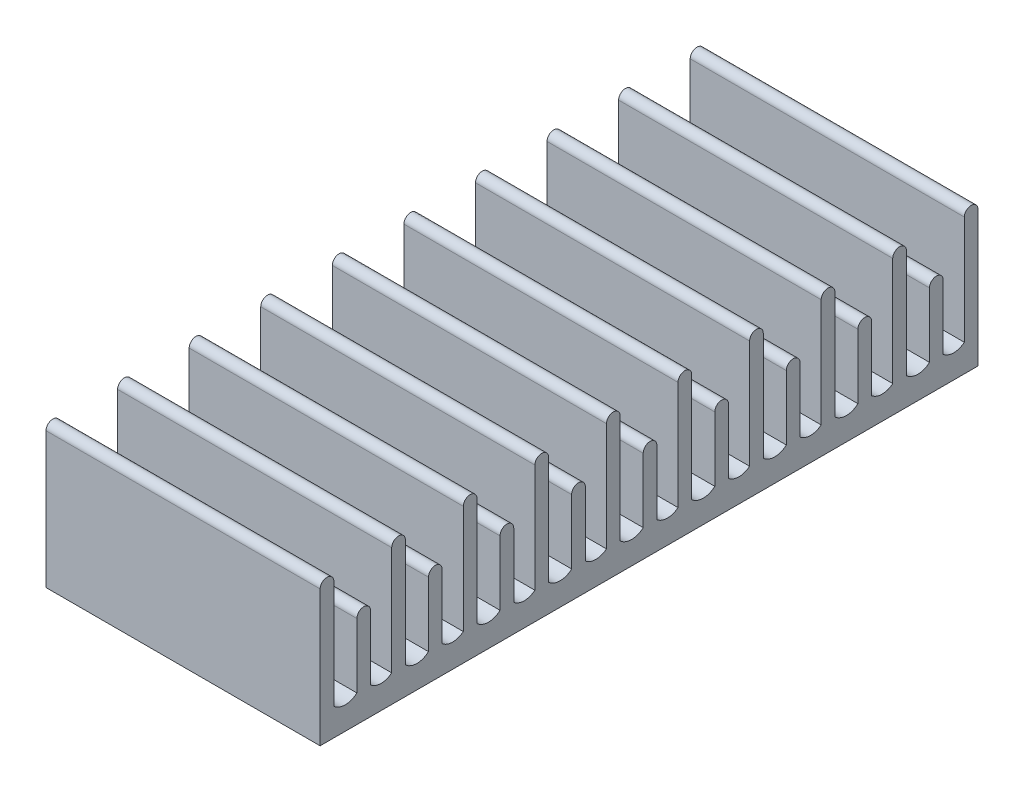
from build123d import *

# Parameters (mm, degrees)
BOSS_EXTRUDE1_DEPTH = 25


with BuildPart() as part:
    # Sketch1 → Boss-Extrude1 (new, symmetric)
    with BuildSketch(Plane(origin=(0, 0, 0), x_dir=(0, 0, -1), z_dir=(1, 0, 0))):
        with BuildLine():
            Line((-60, 6.039014916), (60, 6.039014916))
            Line((60, 6.039014916), (60, 30.818764411))
            ThreePointArc((60, 30.818764411), (58.750354063, 32.039014916), (57.500708126, 30.818764411))
            Line((57.500708126, 30.818764411), (57.500708126, 11.039014916))
            ThreePointArc((57.500708126, 11.039014916), (55.57729196, 10.33874836), (53.653875793, 11.039014916))
            Line((53.653875793, 11.039014916), (53.653875793, 22.789014916))
            ThreePointArc((53.653875793, 22.789014916), (52.403875793, 24.039014916), (51.153875793, 22.789014916))
            Line((51.153875793, 22.789014916), (51.153875793, 11.039014916))
            ThreePointArc((51.153875793, 11.039014916), (49.049120778, 10.219058782), (46.944365764, 11.039014916))
            Line((46.944365764, 11.039014916), (46.944365764, 30.818764411))
            ThreePointArc((46.944365764, 30.818764411), (45.694719827, 32.039014916), (44.44507389, 30.818764411))
            Line((44.44507389, 30.818764411), (44.44507389, 11.039014916))
            ThreePointArc((44.44507389, 11.039014916), (42.521657723, 10.33874836), (40.598241557, 11.039014916))
            Line((40.598241557, 11.039014916), (40.598241557, 22.789014916))
            ThreePointArc((40.598241557, 22.789014916), (39.348241557, 24.039014916), (38.098241557, 22.789014916))
            Line((38.098241557, 22.789014916), (38.098241557, 11.039014916))
            ThreePointArc((38.098241557, 11.039014916), (35.993486542, 10.219058782), (33.888731528, 11.039014916))
            Line((33.888731528, 11.039014916), (33.888731528, 30.818764411))
            ThreePointArc((33.888731528, 30.818764411), (32.639085591, 32.039014916), (31.389439654, 30.818764411))
            Line((31.389439654, 30.818764411), (31.389439654, 11.039014916))
            ThreePointArc((31.389439654, 11.039014916), (29.466023487, 10.33874836), (27.54260732, 11.039014916))
            Line((27.54260732, 11.039014916), (27.54260732, 22.789014916))
            ThreePointArc((27.54260732, 22.789014916), (26.29260732, 24.039014916), (25.04260732, 22.789014916))
            Line((25.04260732, 22.789014916), (25.04260732, 11.039014916))
            ThreePointArc((25.04260732, 11.039014916), (22.937852306, 10.219058782), (20.833097291, 11.039014916))
            Line((20.833097291, 11.039014916), (20.833097291, 30.818764411))
            ThreePointArc((20.833097291, 30.818764411), (19.583451354, 32.039014916), (18.333805417, 30.818764411))
            Line((18.333805417, 30.818764411), (18.333805417, 11.039014916))
            ThreePointArc((18.333805417, 11.039014916), (16.410389251, 10.33874836), (14.486973084, 11.039014916))
            Line((14.486973084, 11.039014916), (14.486973084, 22.789014916))
            ThreePointArc((14.486973084, 22.789014916), (13.236973084, 24.039014916), (11.986973084, 22.789014916))
            Line((11.986973084, 22.789014916), (11.986973084, 11.039014916))
            ThreePointArc((11.986973084, 11.039014916), (9.88221807, 10.219058782), (7.777463055, 11.039014916))
            Line((7.777463055, 11.039014916), (7.777463055, 30.818764411))
            ThreePointArc((7.777463055, 30.818764411), (6.527817118, 32.039014916), (5.278171181, 30.818764411))
            Line((5.278171181, 30.818764411), (5.278171181, 11.039014916))
            ThreePointArc((5.278171181, 11.039014916), (3.354755015, 10.33874836), (1.431338848, 11.039014916))
            Line((1.431338848, 11.039014916), (1.431338848, 22.789014916))
            ThreePointArc((1.431338848, 22.789014916), (0.181338848, 24.039014916), (-1.068661152, 22.789014916))
            Line((-1.068661152, 22.789014916), (-1.068661152, 11.039014916))
            ThreePointArc((-1.068661152, 11.039014916), (-3.173416167, 10.219058782), (-5.278171181, 11.039014916))
            Line((-5.278171181, 11.039014916), (-5.278171181, 30.818764411))
            ThreePointArc((-5.278171181, 30.818764411), (-6.527817118, 32.039014916), (-7.777463055, 30.818764411))
            Line((-7.777463055, 30.818764411), (-7.777463055, 11.039014916))
            ThreePointArc((-7.777463055, 11.039014916), (-9.700879222, 10.33874836), (-11.624295388, 11.039014916))
            Line((-11.624295388, 11.039014916), (-11.624295388, 22.789014916))
            ThreePointArc((-11.624295388, 22.789014916), (-12.874295388, 24.039014916), (-14.124295388, 22.789014916))
            Line((-14.124295388, 22.789014916), (-14.124295388, 11.039014916))
            ThreePointArc((-14.124295388, 11.039014916), (-16.229050403, 10.219058782), (-18.333805417, 11.039014916))
            Line((-18.333805417, 11.039014916), (-18.333805417, 30.818764411))
            ThreePointArc((-18.333805417, 30.818764411), (-19.583451354, 32.039014916), (-20.833097291, 30.818764411))
            Line((-20.833097291, 30.818764411), (-20.833097291, 11.039014916))
            ThreePointArc((-20.833097291, 11.039014916), (-22.756513458, 10.33874836), (-24.679929625, 11.039014916))
            Line((-24.679929625, 11.039014916), (-24.679929625, 22.789014916))
            ThreePointArc((-24.679929625, 22.789014916), (-25.929929625, 24.039014916), (-27.179929625, 22.789014916))
            Line((-27.179929625, 22.789014916), (-27.179929625, 11.039014916))
            ThreePointArc((-27.179929625, 11.039014916), (-29.284684639, 10.219058782), (-31.389439654, 11.039014916))
            Line((-31.389439654, 11.039014916), (-31.389439654, 30.818764411))
            ThreePointArc((-31.389439654, 30.818764411), (-32.639085591, 32.039014916), (-33.888731528, 30.818764411))
            Line((-33.888731528, 30.818764411), (-33.888731528, 11.039014916))
            ThreePointArc((-33.888731528, 11.039014916), (-35.812147694, 10.33874836), (-37.735563861, 11.039014916))
            Line((-37.735563861, 11.039014916), (-37.735563861, 22.789014916))
            ThreePointArc((-37.735563861, 22.789014916), (-38.985563861, 24.039014916), (-40.235563861, 22.789014916))
            Line((-40.235563861, 22.789014916), (-40.235563861, 11.039014916))
            ThreePointArc((-40.235563861, 11.039014916), (-42.340318875, 10.219058782), (-44.44507389, 11.039014916))
            Line((-44.44507389, 11.039014916), (-44.44507389, 30.818764411))
            ThreePointArc((-44.44507389, 30.818764411), (-45.694719827, 32.039014916), (-46.944365764, 30.818764411))
            Line((-46.944365764, 30.818764411), (-46.944365764, 11.039014916))
            ThreePointArc((-46.944365764, 11.039014916), (-48.86778193, 10.33874836), (-50.791198097, 11.039014916))
            Line((-50.791198097, 11.039014916), (-50.791198097, 22.789014916))
            ThreePointArc((-50.791198097, 22.789014916), (-52.041198097, 24.039014916), (-53.291198097, 22.789014916))
            Line((-53.291198097, 22.789014916), (-53.291198097, 11.039014916))
            ThreePointArc((-53.291198097, 11.039014916), (-55.395953112, 10.219058782), (-57.500708126, 11.039014916))
            Line((-57.500708126, 11.039014916), (-57.500708126, 30.818764411))
            ThreePointArc((-57.500708126, 30.818764411), (-58.750354063, 32.039014916), (-60, 30.818764411))
            Line((-60, 30.818764411), (-60, 6.039014916))
        make_face()
    extrude(amount=BOSS_EXTRUDE1_DEPTH, both=True)


solid = part.part
